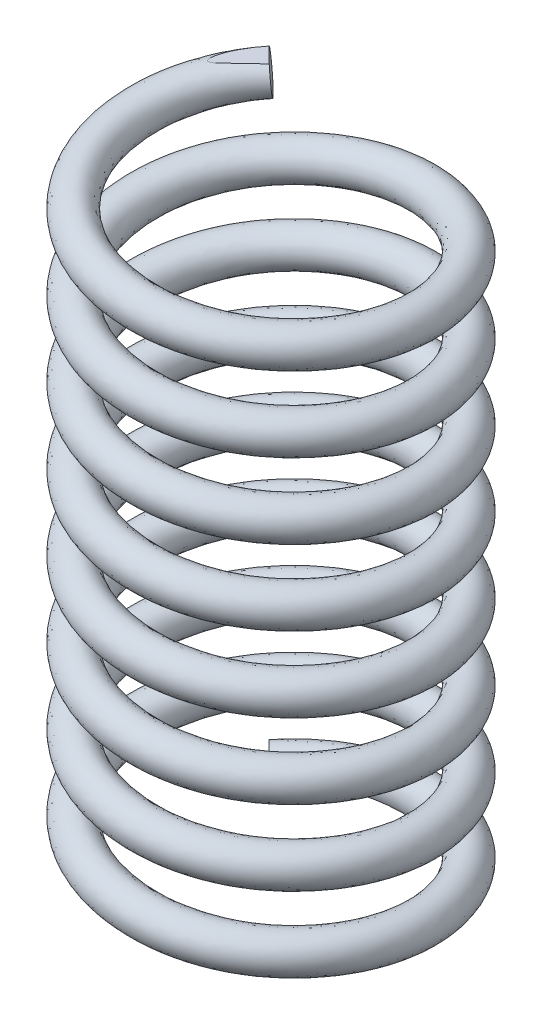
from build123d import *

# Parameters (mm, degrees)
SWEEP1_PITCH            = 0.4025
SWEEP1_HEIGHT           = 3.22
SWEEP1_RADIUS           = 0.75
SWEEP1_START_ANGLE      = -135
SWEEP1_PROFILE_R        = 0.1
CUT_EXTRUDE1_DEPTH      = 4.530578893
CUT_EXTRUDE1_DEPTH_BACK = 4.530578893
SKETCH5_W               = 1
SKETCH5_H               = 0.2
SKETCH5_W_2             = 3
SKETCH5_H_2             = 0.229603296


with BuildPart() as part:
    # Sweep1: sweep along a helix
    with BuildLine() as sweep1_path:
        add(Helix(SWEEP1_PITCH, SWEEP1_HEIGHT, SWEEP1_RADIUS, center=(0, 0, 0), direction=(0, 1, 0), lefthand=True, mode=Mode.PRIVATE).rotate(Axis((0, 0, 0), (0, 1, 0)), SWEEP1_START_ANGLE))
    # Sweep1 profile (on start of the path) → Sweep1 (sweep)
    with BuildSketch(Plane(origin=(-0.530330086, 0, -0.530330086), x_dir=(0.7071067811864836, 0, 0.7071067811866116), z_dir=(0.70454149303562, 0.08510328537993672, -0.7045414930354924))):
        Circle(SWEEP1_PROFILE_R)
    sweep(path=sweep1_path.line, is_frenet=True)

    # Sketch5 → Cut-Extrude1 (cut, two sides: drawn at the far end of the back side and taken through both)
    with BuildSketch(Plane(origin=(0, 0, 0), x_dir=(0, 0, -1), z_dir=(1, 0, 0)).offset(-CUT_EXTRUDE1_DEPTH_BACK)):
        with Locations((0.5, -0.1)):
            Rectangle(SKETCH5_W, SKETCH5_H)
        with Locations((-0.595363013, 3.414801648)):
            Rectangle(SKETCH5_W_2, SKETCH5_H_2)
    extrude(amount=CUT_EXTRUDE1_DEPTH + CUT_EXTRUDE1_DEPTH_BACK, mode=Mode.SUBTRACT)


solid = part.part
